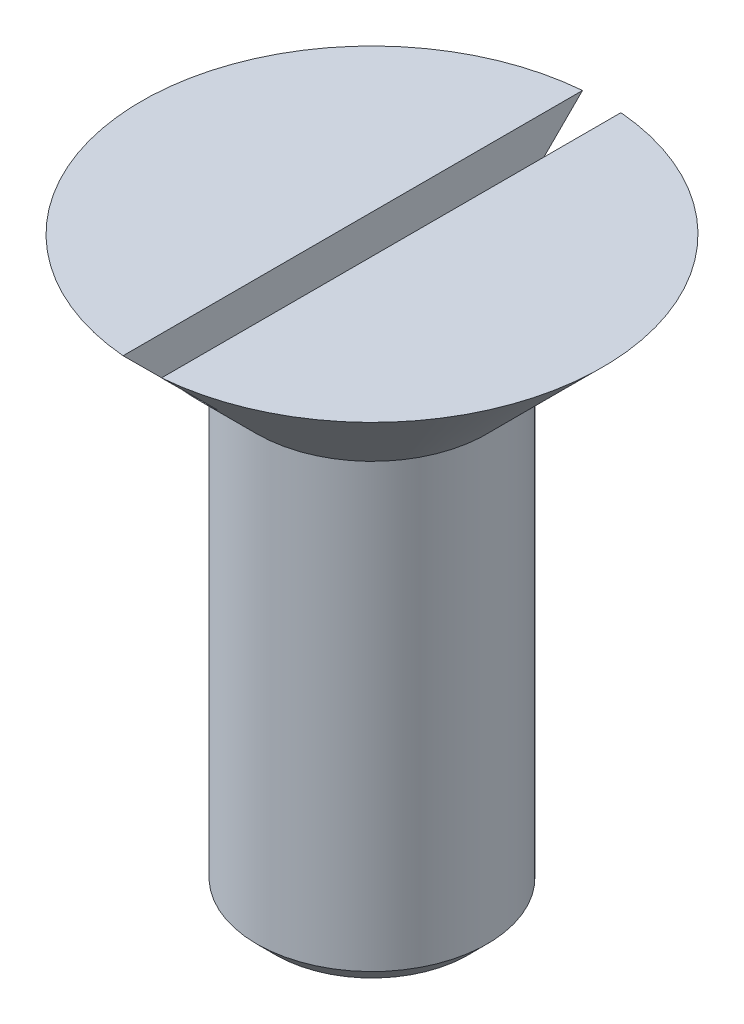
from build123d import *

# Parameters (mm, degrees)
CUT_EXTRUDE1_DEPTH      = 35.467375879
CUT_EXTRUDE1_DEPTH_BACK = 35.467375879
SKETCH2_W               = 2
SKETCH2_H               = 6


with BuildPart() as part:
    # Sketch1 → Revolve1 (revolve)
    with BuildSketch(Plane.XY, mode=Mode.PRIVATE) as revolve1_sk:
        Polygon((0, 0), (5, 0), (6, 1), (6, 24), (12, 30), (0, 30), align=None)
    revolve(revolve1_sk.sketch.rotate(Axis((0, 23.331288201, 0), (0, -1, 0)), 90), axis=Axis((0, 23.331288201, 0), (0, -1, 0)))

    # Sketch2 → Cut-Extrude1 (cut, two sides: drawn at the far end of the back side and taken through both)
    with BuildSketch(Plane.XY.offset(-CUT_EXTRUDE1_DEPTH_BACK)):
        with Locations((0, 30)):
            Rectangle(SKETCH2_W, SKETCH2_H)
    extrude(amount=CUT_EXTRUDE1_DEPTH + CUT_EXTRUDE1_DEPTH_BACK, mode=Mode.SUBTRACT)


solid = part.part
